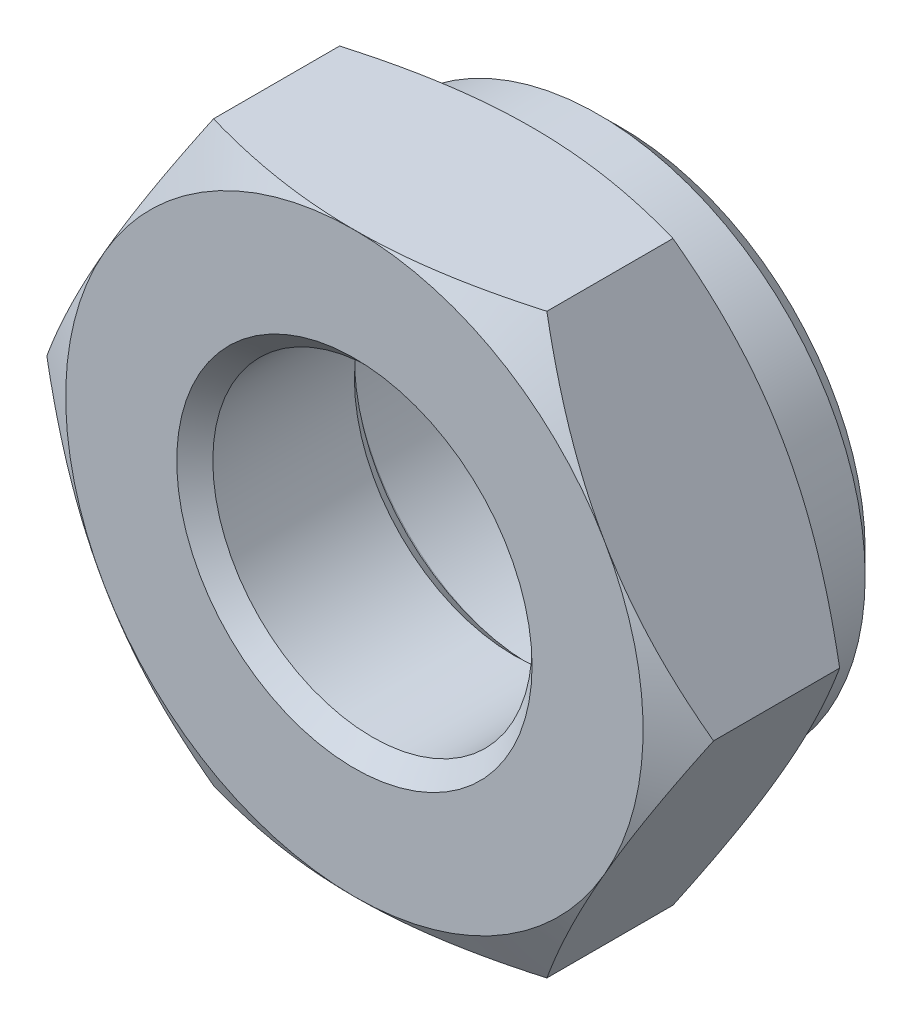
from build123d import *

# Parameters (mm, degrees)
SKETCH3_W          = 26
SKETCH3_H          = 26
CUT_EXTRUDE1_DEPTH = 6


with BuildPart() as part:
    # Sketch1 → Revolve1 (revolve)
    with BuildSketch(Plane(origin=(0, 0, 0), x_dir=(0, 0, -1), z_dir=(1, 0, 0))):
        Polygon((-6, 0), (-6, 6.5), (-5.24944465, 7.8), (-2.75055535, 7.8), (-2, 6.5), (-2, 6), (-0.5, 6), (0, 5.5), (0, 0), align=None)
    revolve(axis=Axis((0, 0, 0), (0, 0, 1)))

    # Sketch2 → Cut-Revolve1 (revolve, cut)
    with BuildSketch(Plane(origin=(0, 0, 0), x_dir=(0, 0, -1), z_dir=(1, 0, 0))):
        with BuildLine():
            Line((-6, 0), (-6, 4))
            Line((-6, 4), (-5.594, 3.594))
            Line((-5.594, 3.594), (-2.406, 3.594))
            Line((-2.406, 3.594), (-2, 4))
            Line((-2, 4), (-2, 4.05))
            ThreePointArc((-2, 4.05), (-1.941421356, 4.191421356), (-1.8, 4.25))
            Line((-1.8, 4.25), (0, 4.25))
            Line((0, 4.25), (0, 0))
            Line((0, 0), (-6, 0))
        make_face()
    revolve(axis=Axis((0, 0, 0), (0, 0, 1)), mode=Mode.SUBTRACT)

    # Sketch3 → Cut-Extrude1 (cut)
    with BuildSketch(Plane.XY):
        Rectangle(SKETCH3_W, SKETCH3_H)
        Polygon((-7.505553499, 0), (-3.75277675, -6.5), (3.75277675, -6.5), (7.505553499, 0), (3.75277675, 6.5), (-3.75277675, 6.5), align=None, mode=Mode.SUBTRACT)
    extrude(amount=CUT_EXTRUDE1_DEPTH, mode=Mode.SUBTRACT)


solid = part.part
